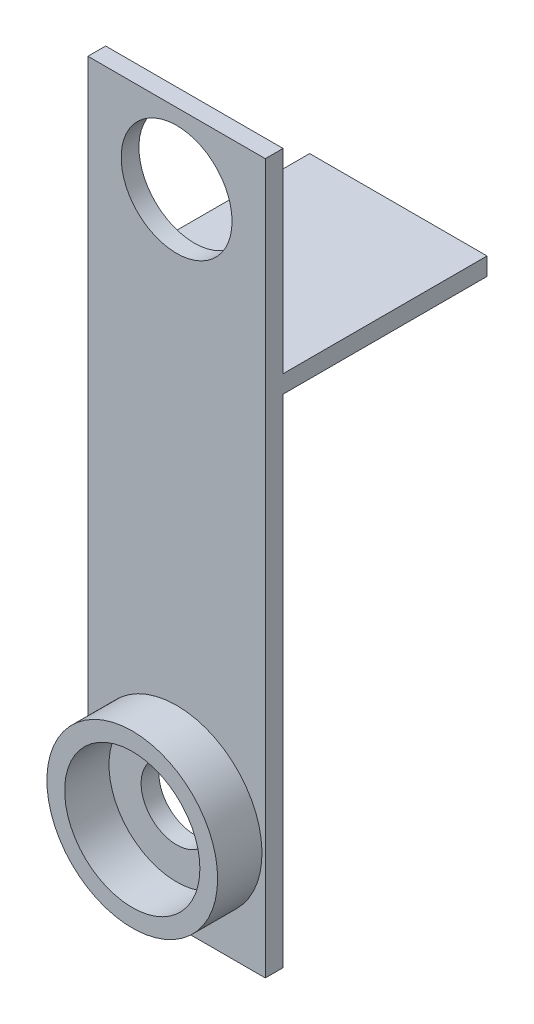
from build123d import *

# Parameters (mm, degrees)
BOSS_EXTRUDE1_DEPTH = 20
SKETCH2_R           = 6.25
SKETCH2_R_2         = 4
CUT_EXTRUDE1_DEPTH  = 15
SKETCH3_R           = 9.625
SKETCH3_R_2         = 7.625
BOSS_EXTRUDE2_DEPTH = 5


with BuildPart() as part:
    # Sketch1 → Boss-Extrude1 (new body)
    with BuildSketch(Plane(origin=(0, 0, 0), x_dir=(0, 0, -1), z_dir=(1, 0, 0))):
        Polygon((0, 22), (0, 0), (23, 0), (23, -2), (0, -2), (0, -58), (-2, -58), (-2, 22), align=None)
    extrude(amount=BOSS_EXTRUDE1_DEPTH)

    # Sketch2 → Cut-Extrude1 (cut)
    with BuildSketch(Plane.XY.offset(2)):
        with Locations((10, 14)):
            Circle(SKETCH2_R)
        with Locations((10, -46)):
            Circle(SKETCH2_R_2)
    extrude(amount=-CUT_EXTRUDE1_DEPTH, mode=Mode.SUBTRACT)

    # Sketch3 → Boss-Extrude2 (add)
    with BuildSketch(Plane.XY.offset(2)):
        with Locations(Location((10, -46, 0), (0, 0, 90))):
            Circle(SKETCH3_R)
        with Locations((10, -46)):
            Circle(SKETCH3_R_2, mode=Mode.SUBTRACT)
    extrude(amount=BOSS_EXTRUDE2_DEPTH)


solid = part.part
